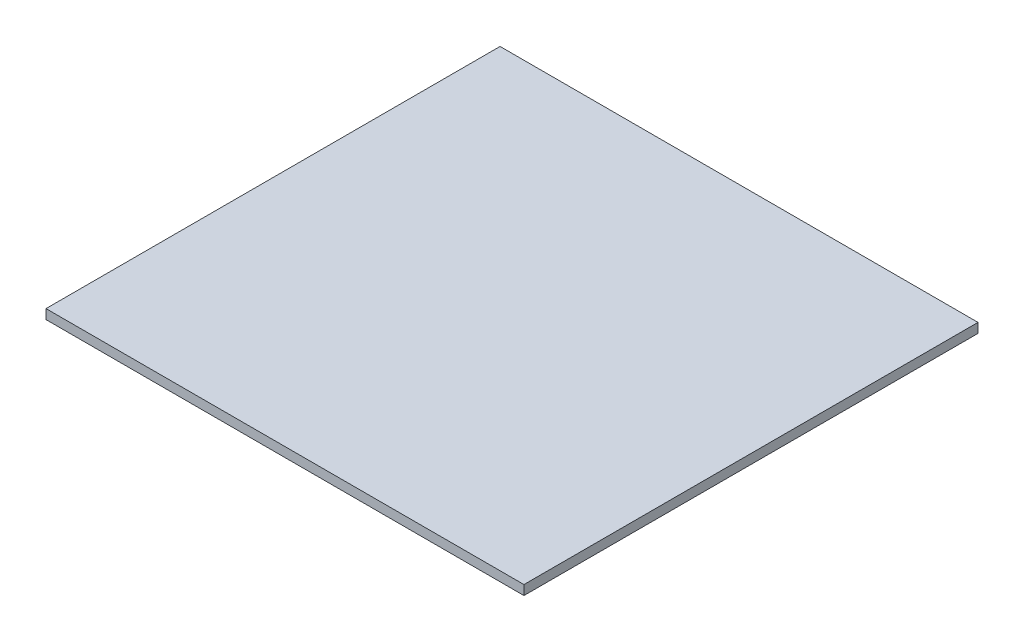
from build123d import *

# Parameters (mm, degrees)
SKETCH1_W           = 100
SKETCH1_H           = 95
BOSS_EXTRUDE1_DEPTH = 1


with BuildPart() as part:
    # Sketch1 → Boss-Extrude1 (new, symmetric)
    with BuildSketch(Plane(origin=(0, 0, 0), x_dir=(1, 0, 0), z_dir=(0, 1, 0))):
        Rectangle(SKETCH1_W, SKETCH1_H)
    extrude(amount=BOSS_EXTRUDE1_DEPTH, both=True)


solid = part.part
